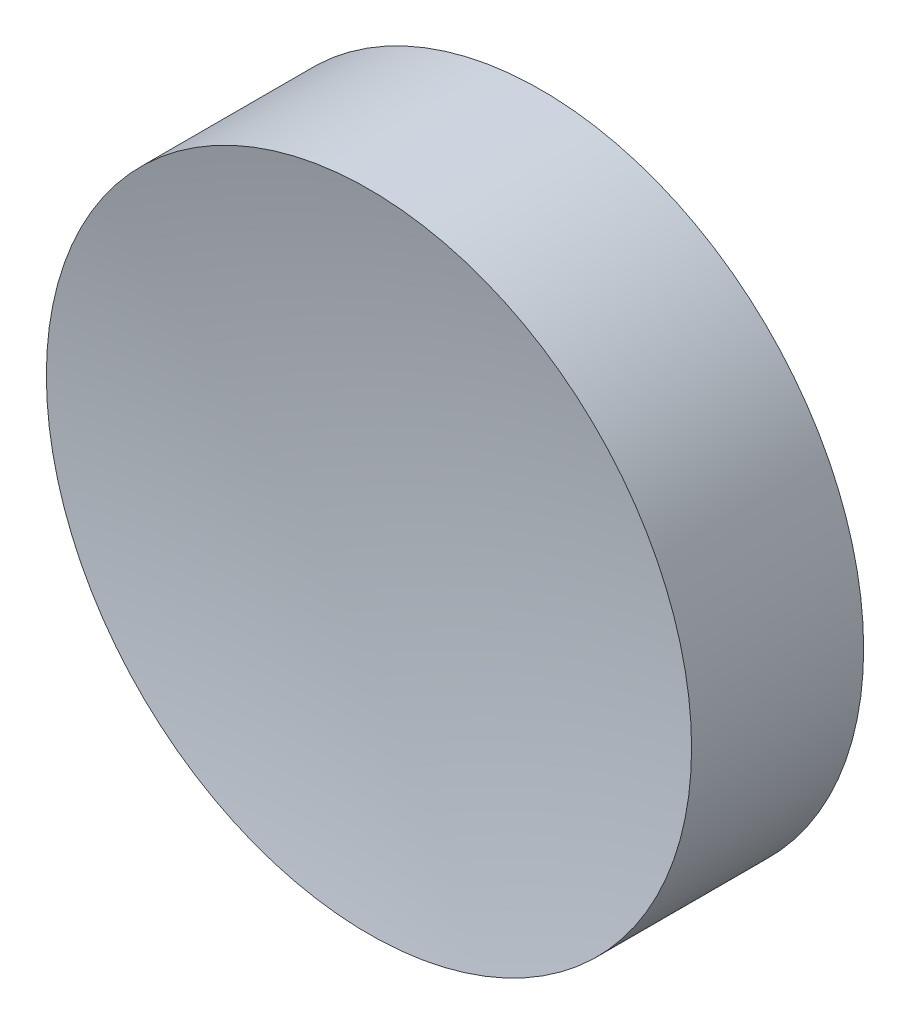
from build123d import *

# Parameters (mm, degrees)
SKETCH1_R           = 30
BOSS_EXTRUDE1_DEPTH = 16
SKETCH4_R           = 2.5
CUT_EXTRUDE2_DEPTH  = 6


with BuildPart() as part:
    # Sketch1 → Boss-Extrude1 (new body)
    with BuildSketch(Plane.XY):
        Circle(SKETCH1_R)
    extrude(amount=BOSS_EXTRUDE1_DEPTH)

    # Sketch3 → Cut-Revolve2 (revolve, cut)
    with BuildSketch(Plane(origin=(0, 0, 0), x_dir=(1, 0, 0), z_dir=(0, 1, 0)), mode=Mode.PRIVATE) as cut_revolve2_sk:
        with BuildLine():
            Line((0, -16), (30, -16))
            ThreePointArc((30, -16), (15.076344301, -13.728961616), (0, -12.969384567))
            Line((0, -12.969384567), (0, -16))
        make_face()
    revolve(cut_revolve2_sk.sketch.rotate(Axis((0, 0, 12.969384567), (0, 0, 1)), 180), axis=Axis((0, 0, 12.969384567), (0, 0, 1)), mode=Mode.SUBTRACT)

    # Sketch4 → Cut-Extrude2 (cut)
    with BuildSketch(Plane(origin=(0, 0, 0), x_dir=(-1, 0, 0), z_dir=(0, 0, -1))):
        with Locations((-16, 0)):
            Circle(SKETCH4_R)
    extrude(amount=-CUT_EXTRUDE2_DEPTH, mode=Mode.SUBTRACT)


solid = part.part
